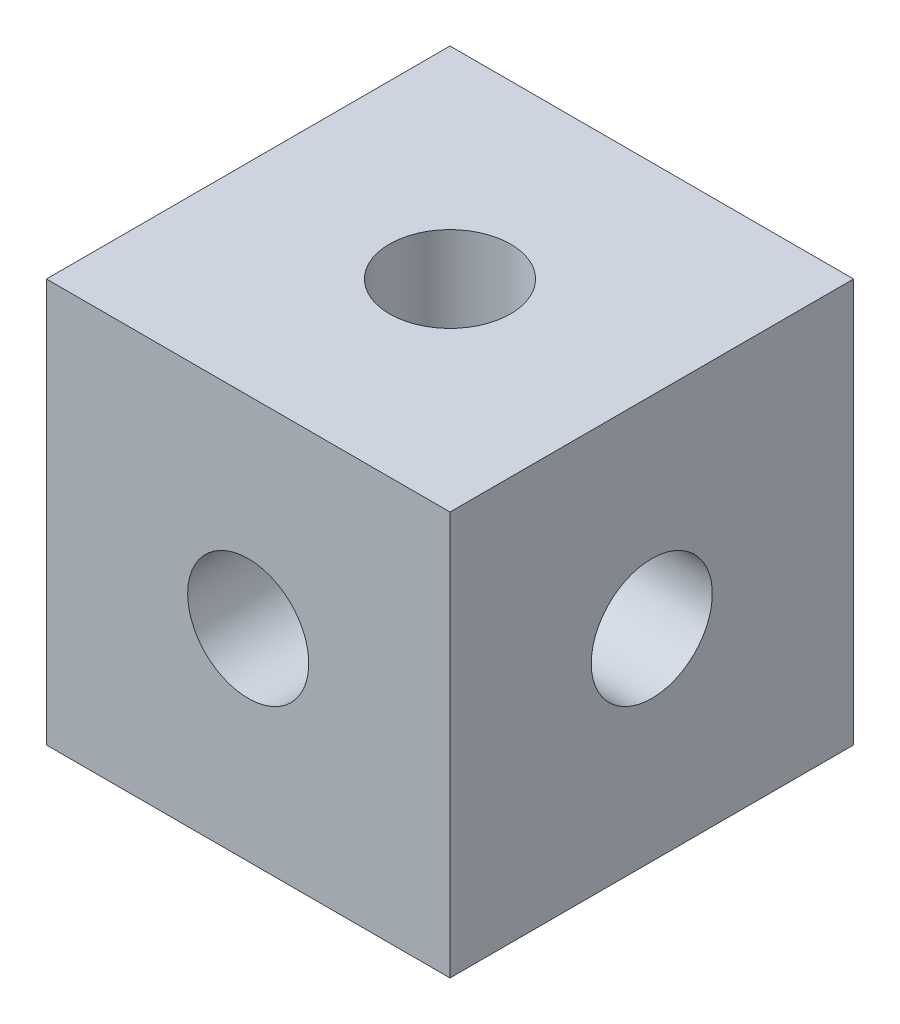
from build123d import *

# Parameters (mm, degrees)
SKETCH_1_W               = 10
SKETCH_1_H               = 10
SKETCH_1_R               = 1.5
EXTRUDE_1_DEPTH          = 10
CUT_EXTRUDE_1_DEPTH      = 18.320508076
CUT_EXTRUDE_1_DEPTH_BACK = 18.320508076
SKETCH_2_R               = 1.5
CUT_EXTRUDE_2_DEPTH      = 18.320508076
CUT_EXTRUDE_2_DEPTH_BACK = 18.320508076
SKETCH_3_R               = 1.5


with BuildPart() as part:
    # 草图1 → 凸台-拉伸1 (new body)
    with BuildSketch(Plane(origin=(0, 0, 0), x_dir=(1, 0, 0), z_dir=(0, 1, 0))):
        with Locations((5, 5)):
            Rectangle(SKETCH_1_W, SKETCH_1_H)
        with Locations(Location((5, 5, 0), (0, 0, 270))):
            Circle(SKETCH_1_R, mode=Mode.SUBTRACT)
    extrude(amount=EXTRUDE_1_DEPTH)

    # 草图2 → 切除-拉伸1 (cut, two sides: drawn at the far end of the back side and taken through both)
    with BuildSketch(Plane.XY.offset(-CUT_EXTRUDE_1_DEPTH_BACK)):
        with Locations((5, 5)):
            Circle(SKETCH_2_R)
    extrude(amount=CUT_EXTRUDE_1_DEPTH + CUT_EXTRUDE_1_DEPTH_BACK, mode=Mode.SUBTRACT)

    # 草图3 → 切除-拉伸2 (cut, two sides: drawn at the far end of the back side and taken through both)
    with BuildSketch(Plane.ZY.offset(-CUT_EXTRUDE_2_DEPTH_BACK)):
        with Locations(Location((-5, 5, 0), (0, 0, 315))):
            Circle(SKETCH_3_R)
    extrude(amount=CUT_EXTRUDE_2_DEPTH + CUT_EXTRUDE_2_DEPTH_BACK, mode=Mode.SUBTRACT)


solid = part.part
